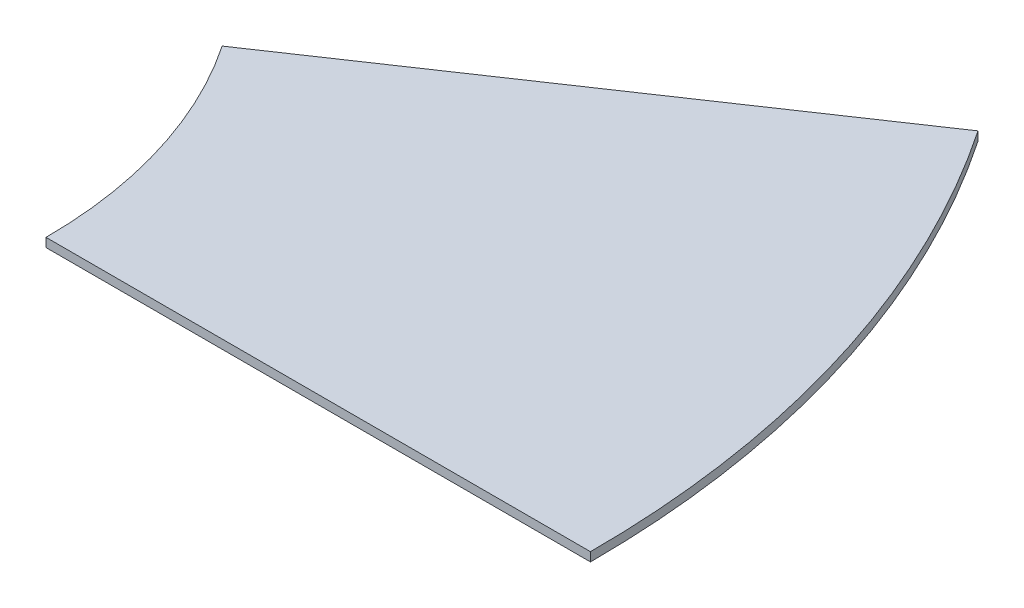
from build123d import *

# Parameters (mm, degrees)
EXTRUDE_1_DEPTH = 0.98


with BuildPart() as part:
    # 草图1 → 凸台-拉伸1 (new body)
    with BuildSketch(Plane(origin=(0, 0, 0), x_dir=(1, 0, 0), z_dir=(0, 1, 0))):
        with BuildLine():
            Line((91.194132981, 61.511219382), (41.451878628, 27.959645174))
            ThreePointArc((41.451878628, 27.959645174), (47.815237798, 14.618585236), (50, 0))
            Line((50, 0), (110, 0))
            ThreePointArc((110, 0), (105.193523156, 32.16088752), (91.194132981, 61.511219382))
        make_face()
    extrude(amount=EXTRUDE_1_DEPTH)


solid = part.part
